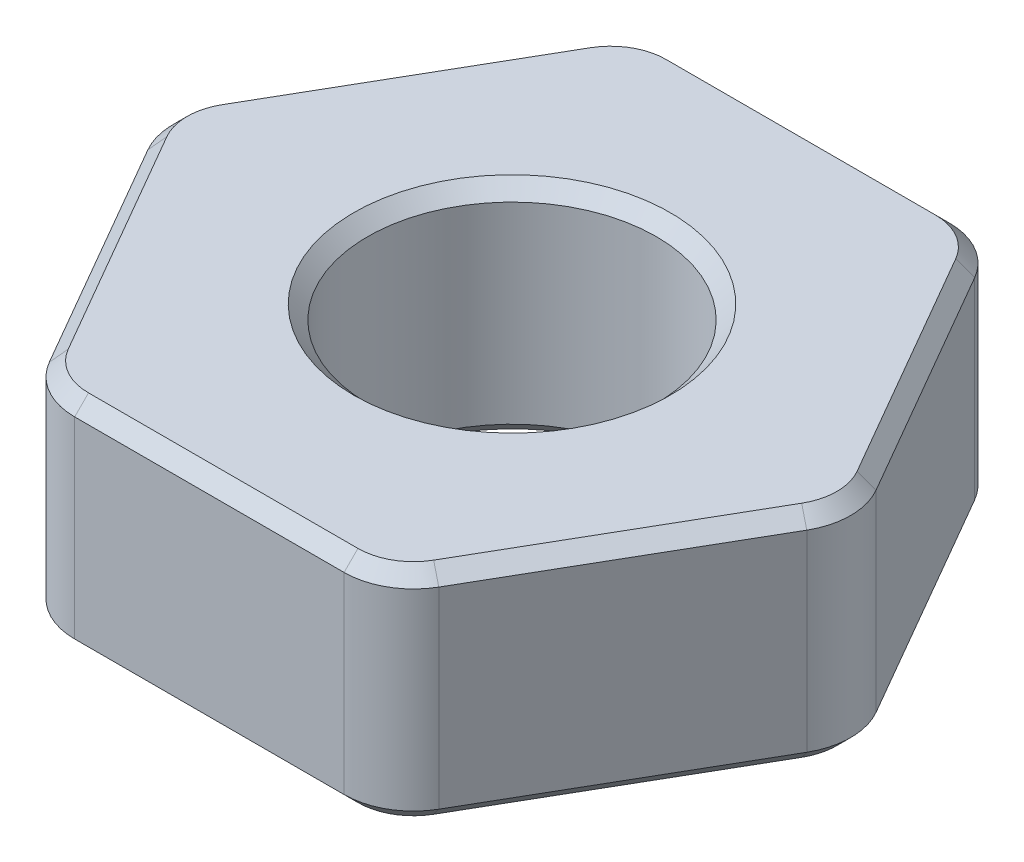
from build123d import *

# Parameters (mm, degrees)
SKETCH1_R           = 2.0828
BOSS_EXTRUDE1_DEPTH = 1.5875
FILLET1_R           = 1
CHAMFER1_SIZE       = 0.2


with BuildPart() as part:
    # Sketch1 → Boss-Extrude1 (new, symmetric)
    with BuildSketch(Plane(origin=(0, 0, 0), x_dir=(1, 0, 0), z_dir=(0, 1, 0))):
        Polygon((2.520494769, 4.365625), (-2.520494769, 4.365625), (-5.040989538, 0), (-2.520494769, -4.365625), (2.520494769, -4.365625), (5.040989538, 0), align=None)
        with Locations(Location((0, 0, 0), (0, 0, 270))):
            Circle(SKETCH1_R, mode=Mode.SUBTRACT)
    extrude(amount=BOSS_EXTRUDE1_DEPTH, both=True)

    # Fillet1
    fillet1_edges = [part.edges().sort_by_distance(p)[0] for p in [
        (5.040989538, 0, 0),
        (2.520494769, 0, 4.365625),
        (-2.520494769, 0, 4.365625),
        (-5.040989538, 0, 0),
        (-2.520494769, 0, -4.365625),
        (2.520494769, 0, -4.365625),
    ]]
    fillet(fillet1_edges, radius=FILLET1_R)

    # Chamfer1
    chamfer1_edges = [part.edges().sort_by_distance(p)[0] for p in [
        (0, -1.5875, -2.0828),
        (0, 1.5875, -2.0828),
        (3.780742153, -1.5875, -2.1828125),
        (3.780742153, 1.5875, -2.1828125),
        (3.780742153, -1.5875, 2.1828125),
        (0, -1.5875, 4.365625),
        (-3.780742153, -1.5875, 2.1828125),
        (-3.780742153, -1.5875, -2.1828125),
        (0, -1.5875, -4.365625),
        (-2.4431445, -1.5875, 4.231650404),
        (2.4431445, -1.5875, -4.231650404),
        (-2.4431445, -1.5875, -4.231650404),
        (-4.886288999, -1.5875, 0),
        (2.4431445, -1.5875, 4.231650404),
        (4.886288999, -1.5875, 0),
        (3.780742153, 1.5875, 2.1828125),
        (0, 1.5875, -4.365625),
        (-3.780742153, 1.5875, -2.1828125),
        (-3.780742153, 1.5875, 2.1828125),
        (0, 1.5875, 4.365625),
        (-2.4431445, 1.5875, 4.231650404),
        (2.4431445, 1.5875, -4.231650404),
        (-2.4431445, 1.5875, -4.231650404),
        (-4.886288999, 1.5875, 0),
        (2.4431445, 1.5875, 4.231650404),
        (4.886288999, 1.5875, 0),
    ]]
    chamfer(chamfer1_edges, length=CHAMFER1_SIZE)


solid = part.part
